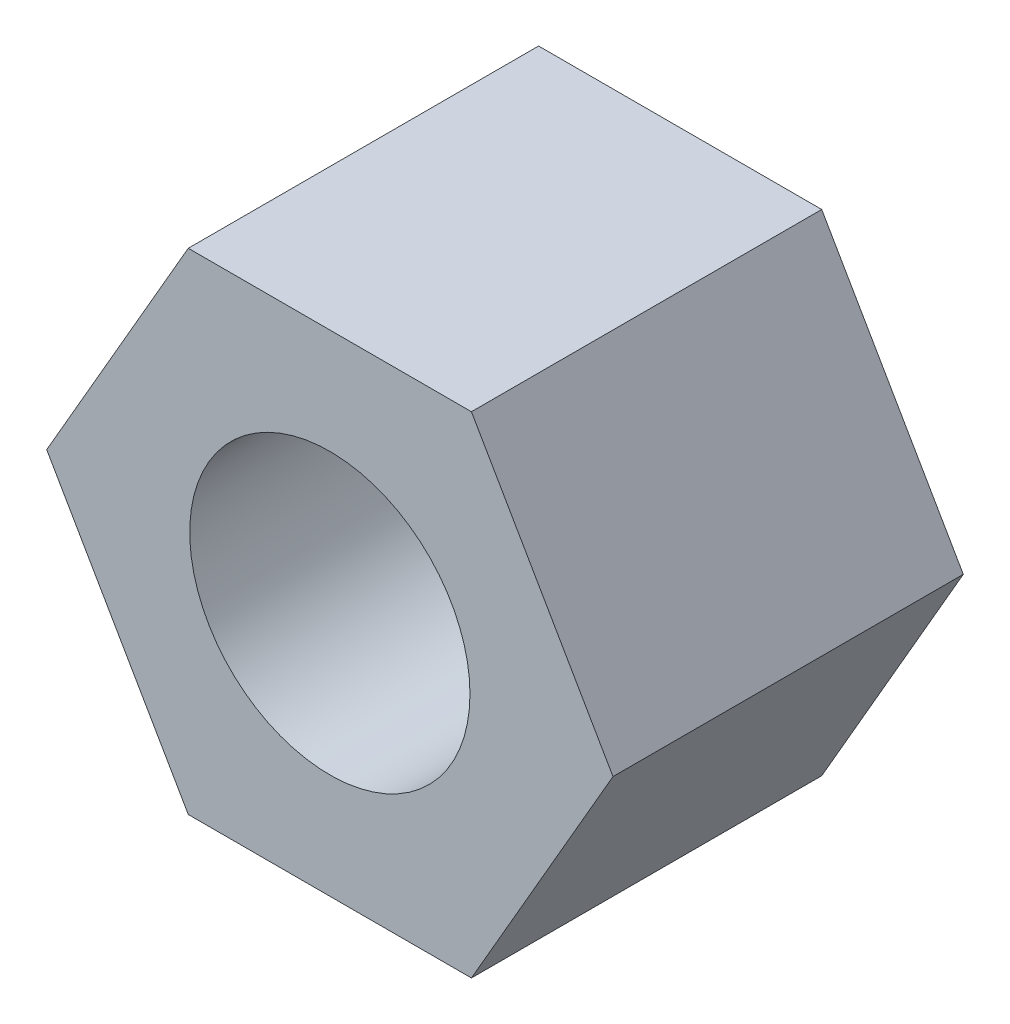
from build123d import *

# Parameters (mm, degrees)
BOSS_EXTRUDE1_DEPTH = 50
SKETCH2_R           = 20
CUT_EXTRUDE1_DEPTH  = 50


with BuildPart() as part:
    # Sketch1 → Boss-Extrude1 (new body)
    with BuildSketch(Plane.XY):
        Polygon((-40.414518843, 0), (-20.207259422, -35), (20.207259422, -35), (40.414518843, 0), (20.207259422, 35), (-20.207259422, 35), align=None)
    extrude(amount=BOSS_EXTRUDE1_DEPTH)

    # Sketch2 → Cut-Extrude1 (cut)
    with BuildSketch(Plane.XY.offset(50)):
        Circle(SKETCH2_R)
    extrude(amount=-CUT_EXTRUDE1_DEPTH, mode=Mode.SUBTRACT)


solid = part.part
